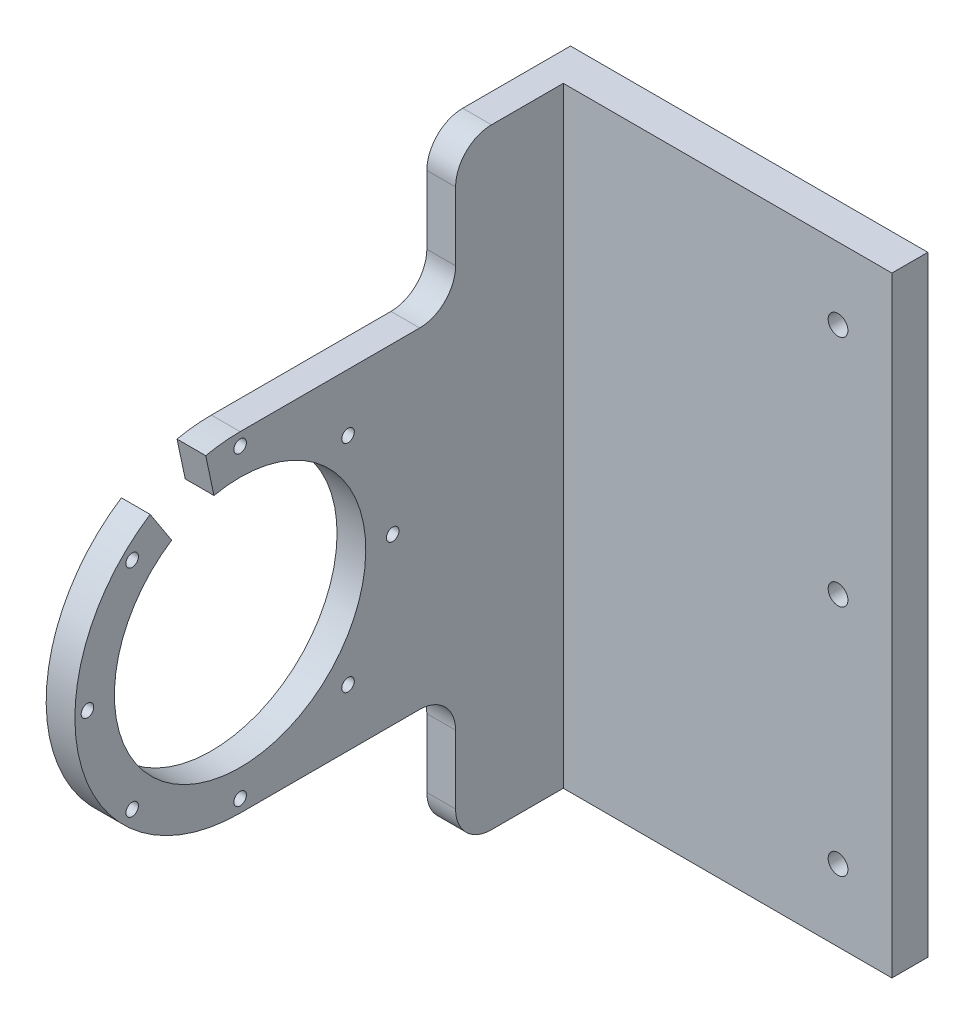
from build123d import *

# Parameters (mm, degrees)
EXTRUDE_1_DEPTH     = 170
SKETCH_2_R          = 35
CUT_EXTRUDE_1_DEPTH = 180
SKETCH_5_W          = 10
SKETCH_5_H          = 170
EXTRUDE_3_DEPTH     = 101.5
SKETCH_6_R          = 2.75
CUT_EXTRUDE_3_DEPTH = 52
FILLET_2_R          = 10
SKETCH_11_R         = 1.75
CUT_EXTRUDE_5_DEPTH = 10
CUT_EXTRUDE_6_DEPTH = 13
MOVE_FACE_2_BY      = 10


with BuildPart() as part:
    # 草图1 → 凸台-拉伸1 (new body)
    with BuildSketch(Plane(origin=(0, 0, 0), x_dir=(1, 0, 0), z_dir=(0, 1, 0))):
        Polygon((8, -10), (8, -300), (0, -300), (0, 0), (8, 0), align=None)
    extrude(amount=EXTRUDE_1_DEPTH)

    # 草图2 → 切除-拉伸1 (cut)
    with BuildSketch(Plane(origin=(8, 0, 0), x_dir=(0, 0, -1), z_dir=(1, 0, 0))):
        with Locations((-100, 85)):
            Circle(SKETCH_2_R)
        with BuildLine():
            Line((-100, 131), (-40, 131))
            Line((-40, 131), (-40, 170))
            Line((-40, 170), (-300, 170))
            Line((-300, 170), (-300, 0))
            Line((-300, 0), (-40, 0))
            Line((-40, 0), (-40, 39))
            Line((-40, 39), (-100, 39))
            ThreePointArc((-100, 39), (-146, 85), (-100, 131))
        make_face()
    extrude(amount=-CUT_EXTRUDE_1_DEPTH, mode=Mode.SUBTRACT)

    # 草图5 → 凸台-拉伸3 (add)
    with BuildSketch(Plane(origin=(8, 0, 0), x_dir=(0, 0, -1), z_dir=(1, 0, 0))):
        with Locations((-5, 85)):
            Rectangle(SKETCH_5_W, SKETCH_5_H)
    extrude(amount=EXTRUDE_3_DEPTH)

    # 草图6 → 切除-拉伸3 (cut)
    with BuildSketch(Plane(origin=(0, 0, 0), x_dir=(-1, 0, 0), z_dir=(0, 0, -1))):
        with Locations((-84.5, 150)):
            Circle(SKETCH_6_R)
        with Locations((-84.5, 20)):
            Circle(SKETCH_6_R)
        with Locations((-84.5, 85)):
            Circle(SKETCH_6_R)
    extrude(amount=-CUT_EXTRUDE_3_DEPTH, mode=Mode.SUBTRACT)

    # 圆角2
    fillet_2_edges = [part.edges().sort_by_distance(p)[0] for p in [
        (4, 0, 40),
        (4, 170, 40),
        (4, 131, 40),
        (4, 39, 40),
    ]]
    fillet(fillet_2_edges, radius=FILLET_2_R)

    # 草图11 → 切除-拉伸5 (cut)
    with BuildSketch(Plane.ZY):
        with Locations((130.0520382, 54.9479618)):
            Circle(SKETCH_11_R)
        with Locations((100, 42.5)):
            Circle(SKETCH_11_R)
        with Locations((69.9479618, 115.0520382)):
            Circle(SKETCH_11_R)
        with Locations((100, 127.5)):
            Circle(SKETCH_11_R)
        with Locations((130.0520382, 115.0520382)):
            Circle(SKETCH_11_R)
        with Locations((142.5, 85)):
            Circle(SKETCH_11_R)
        with Locations((69.9479618, 54.9479618)):
            Circle(SKETCH_11_R)
        with Locations((57.5, 85)):
            Circle(SKETCH_11_R)
    extrude(amount=-CUT_EXTRUDE_5_DEPTH, mode=Mode.SUBTRACT)

    # 草图12 → 切除-拉伸6 (cut)
    with BuildSketch(Plane.ZY):
        with BuildLine():
            Line((100, 85), (110.395584541, 133.907380037))
            ThreePointArc((110.395584541, 133.907380037), (119.134171618, 131.193976626), (127.231951751, 126.933528397))
            Line((127.231951751, 126.933528397), (100, 85))
        make_face()
    extrude(amount=-CUT_EXTRUDE_6_DEPTH, mode=Mode.SUBTRACT)

    # Move Face 2: a face moved inward by 10.0
    extrude(part.faces().sort_by_distance((109.5, 85, 5))[0], amount=MOVE_FACE_2_BY, dir=(-1, 0, 0), mode=Mode.SUBTRACT)


solid = part.part
